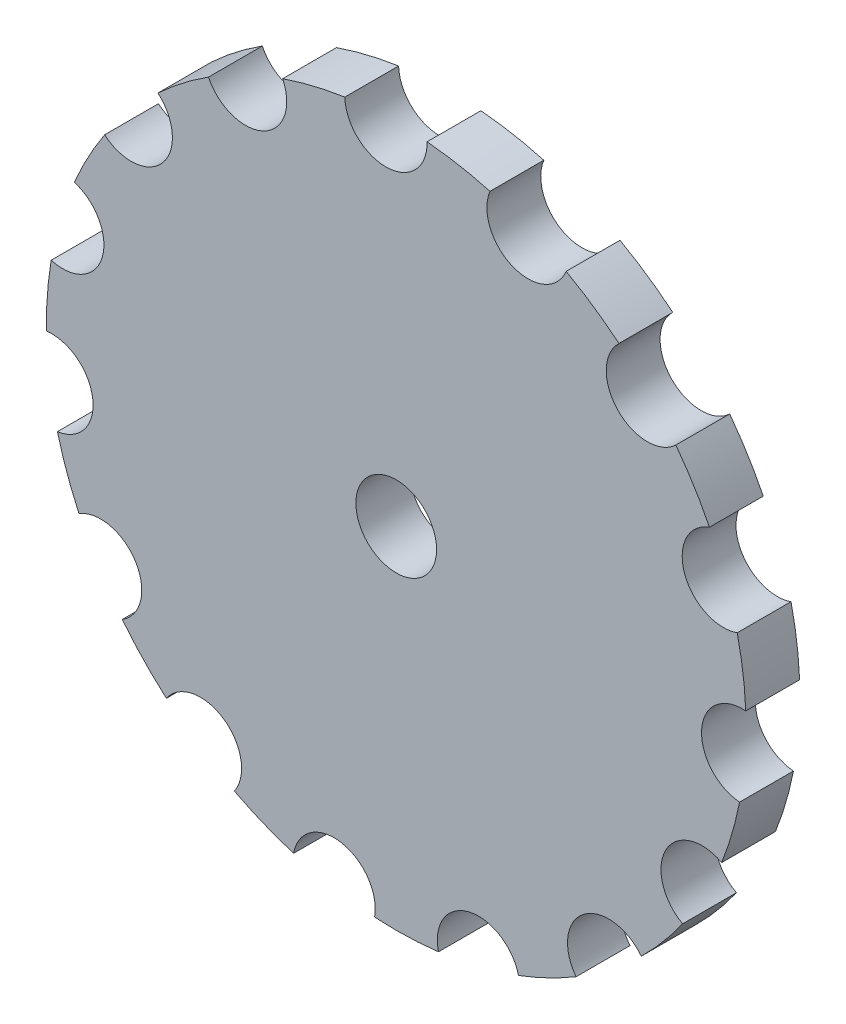
from build123d import *

# Parameters (mm, degrees)
SKETCH1_R               = 65
BOSS_EXTRUDE1_DEPTH     = 10
CUT_EXTRUDE4_DEPTH      = 93.466210045
CUT_EXTRUDE4_DEPTH_BACK = 93.466210045
SKETCH2_OUTSIDE_W       = 168.824
SKETCH2_OUTSIDE_H       = 168.824
SKETCH3_R               = 7.5
CUT_EXTRUDE5_DEPTH      = 10


with BuildPart() as part:
    # Sketch1 → Boss-Extrude1 (new body)
    with BuildSketch(Plane.XY):
        Circle(SKETCH1_R)
    extrude(amount=BOSS_EXTRUDE1_DEPTH)

    # Sketch2 outside → Cut-Extrude4 (cut, two sides: drawn at the far end of the back side and taken through both)
    with BuildSketch(Plane(origin=(0, 0, 0), x_dir=(-1, 0, 0), z_dir=(0, 0, -1)).offset(-CUT_EXTRUDE4_DEPTH_BACK)):
        Rectangle(SKETCH2_OUTSIDE_W, SKETCH2_OUTSIDE_H)
        with BuildLine():
            ThreePointArc((-5.730851082, 64.746871321), (-11.623493415, 63.952282217), (-17.418870891, 62.62254336))
            ThreePointArc((-17.418870891, 62.62254336), (-21.592454328, 52.644679623), (-31.570318066, 56.818263061))
            ThreePointArc((-31.570318066, 56.818263061), (-36.630326198, 53.695616233), (-41.383813447, 50.123646961))
            ThreePointArc((-41.383813447, 50.123646961), (-41.138208837, 39.310865549), (-51.950990248, 39.065260939))
            ThreePointArc((-51.950990248, 39.065260939), (-55.303442804, 34.154490393), (-58.193118697, 28.957916642))
            ThreePointArc((-58.193118697, 28.957916642), (-53.570793308, 19.179845694), (-63.348864256, 14.557520305))
            ThreePointArc((-63.348864256, 14.557520305), (-64.414091734, 8.707742879), (-64.940305058, 2.785099462))
            ThreePointArc((-64.940305058, 2.785099462), (-56.740500941, -4.267543725), (-63.793144129, -12.467347841))
            ThreePointArc((-63.793144129, -12.467347841), (-62.38695902, -18.244652485), (-60.458722709, -23.869286717))
            ThreePointArc((-60.458722709, -23.869286717), (-50.099260491, -26.977036065), (-53.207009838, -37.336498283))
            ThreePointArc((-53.207009838, -37.336498283), (-49.572554323, -42.042381687), (-45.523277954, -46.396456377))
            ThreePointArc((-45.523277954, -46.396456377), (-34.795402763, -45.02195379), (-33.420900177, -55.749828981))
            ThreePointArc((-33.420900177, -55.749828981), (-28.186604631, -58.570601153), (-22.716444875, -60.90125723))
            ThreePointArc((-22.716444875, -60.90125723), (-13.475103792, -55.282166693), (-7.856013255, -64.523507776))
            ThreePointArc((-7.856013255, -64.523507776), (-1.926934931, -64.971431582), (4.018267896, -64.875677439))
            ThreePointArc((4.018267896, -64.875677439), (10.175163042, -55.983590753), (19.067249728, -62.140485899))
            ThreePointArc((19.067249728, -62.140485899), (24.665919324, -60.138111243), (30.058185642, -57.632503641))
            ThreePointArc((30.058185642, -57.632503641), (32.066051748, -47.004943376), (42.693612013, -49.012809482))
            ThreePointArc((42.693612013, -49.012809482), (46.993812045, -44.906365133), (50.900770021, -40.424146388))
            ThreePointArc((50.900770021, -40.424146388), (48.412428796, -29.898714263), (58.937860921, -27.410373038))
            ThreePointArc((58.937860921, -27.410373038), (61.196047738, -21.90990053), (62.942148845, -16.226086984))
            ThreePointArc((62.942148845, -16.226086984), (56.387857092, -7.622725833), (64.991218242, -1.06843408))
            ThreePointArc((64.991218242, -1.06843408), (64.816930829, 4.87498492), (64.100258321, 10.77761027))
            ThreePointArc((64.100258321, 10.77761027), (54.613312629, 15.971301144), (59.807003503, 25.458246837))
            ThreePointArc((59.807003503, 25.458246837), (57.230377735, 30.816941189), (54.174850802, 35.917760796))
            ThreePointArc((54.174850802, 35.917760796), (43.395630266, 36.803745059), (44.281614528, 47.582965594))
            ThreePointArc((44.281614528, 47.582965594), (39.74817241, 51.430368364), (34.882119415, 54.847404178))
            ThreePointArc((34.882119415, 54.847404178), (24.674449193, 51.272487101), (21.099532116, 61.480157323))
            ThreePointArc((21.099532116, 61.480157323), (15.393146975, 63.151017618), (9.557952688, 64.293433105))
            ThreePointArc((9.557952688, 64.293433105), (1.686831695, 56.875750328), (-5.730851082, 64.746871321))
        make_face(mode=Mode.SUBTRACT)
    extrude(amount=CUT_EXTRUDE4_DEPTH + CUT_EXTRUDE4_DEPTH_BACK, mode=Mode.SUBTRACT)

    # Sketch3 → Cut-Extrude5 (cut)
    with BuildSketch(Plane.XY.offset(10)):
        Circle(SKETCH3_R)
    extrude(amount=-CUT_EXTRUDE5_DEPTH, mode=Mode.SUBTRACT)


solid = part.part
